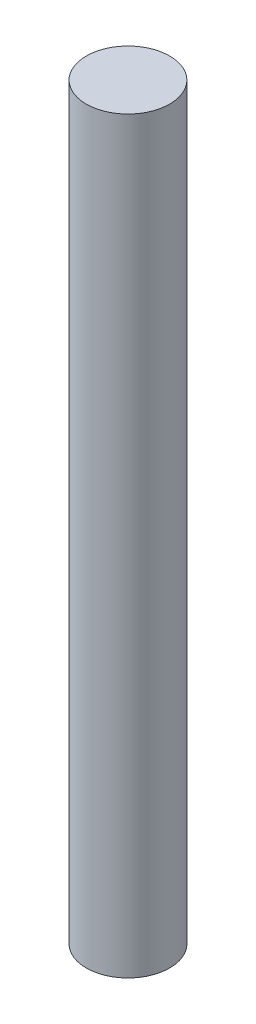
from build123d import *

# Parameters (mm, degrees)
SKETCH1_R           = 1.95
BOSS_EXTRUDE1_DEPTH = 35


with BuildPart() as part:
    # Sketch1 → Boss-Extrude1 (new body)
    with BuildSketch(Plane(origin=(0, 0, 0), x_dir=(1, 0, 0), z_dir=(0, 1, 0))):
        with Locations(Location((0, 0, 0), (0, 0, 270))):
            Circle(SKETCH1_R)
    extrude(amount=BOSS_EXTRUDE1_DEPTH)


solid = part.part
